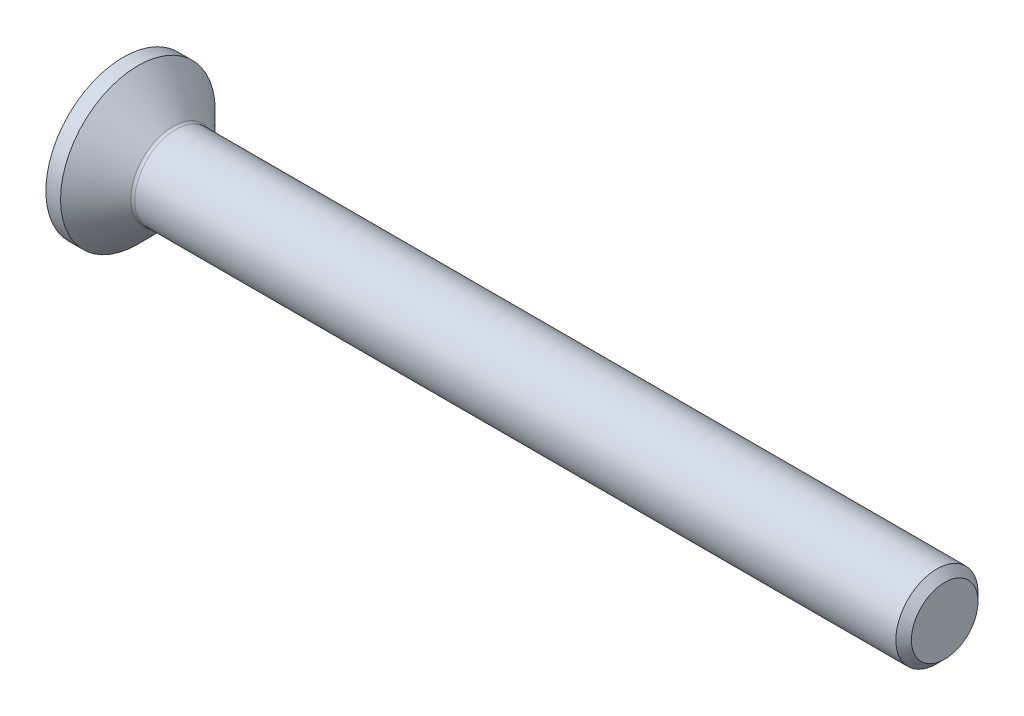
from build123d import *

# Parameters (mm, degrees)
HEXAGONSOCKET_DEPTH = 1.5
HEADFILLET_R        = 0.2
CHAMFER_2_SIZE      = 0.379
SKETCH4_W           = 5
SKETCH4_H           = 5


with BuildPart() as part:
    # Sketch1 → Base (revolve)
    with BuildSketch(Plane.XY, mode=Mode.PRIVATE) as base_sk:
        Polygon((0, 0), (0, 4.48), (2.48, 2), (40, 2), (40, 0), align=None)
    revolve(base_sk.sketch.rotate(Axis((-0.587069181, 0, 0), (1, 0, 0)), 90), axis=Axis((-0.587069181, 0, 0), (1, 0, 0)))

    # Sketch2 → HexagonSocket (cut)
    with BuildSketch(Plane(origin=(0, 0, 0), x_dir=(0, 0, -1), z_dir=(1, 0, 0))):
        Polygon((1.443375673, 0), (0.721687836, 1.25), (-0.721687836, 1.25), (-1.443375673, 0), (-0.721687836, -1.25), (0.721687836, -1.25), align=None)
    extrude(amount=HEXAGONSOCKET_DEPTH, mode=Mode.SUBTRACT)

    # Sketch3 → Cut-Revolve1 (revolve, cut)
    with BuildSketch(Plane.XY, mode=Mode.PRIVATE) as cut_revolve1_sk:
        Polygon((1.5, 1.25), (2.221687836, 0), (1.5, 0), align=None)
    revolve(cut_revolve1_sk.sketch.rotate(Axis((-0.439109555, 0, 0), (1, 0, 0)), 90), axis=Axis((-0.439109555, 0, 0), (1, 0, 0)), mode=Mode.SUBTRACT)

    # HeadFillet
    headfillet_edges = [part.edges().sort_by_distance(p)[0] for p in [
        (2.48, 0, -2),
    ]]
    fillet(headfillet_edges, radius=HEADFILLET_R)

    # Chamfer 2
    chamfer_2_edges = [part.edges().sort_by_distance(p)[0] for p in [
        (40, 0, -2),
    ]]
    chamfer(chamfer_2_edges, length=CHAMFER_2_SIZE)

    # Sketch4 → Cut-Revolve2 (revolve, cut)
    with BuildSketch(Plane(origin=(0, 0, 0), x_dir=(1, 0, 0), z_dir=(0, 1, 0)), mode=Mode.PRIVATE) as cut_revolve2_sk:
        with Locations((0.5, 6.265)):
            Rectangle(SKETCH4_W, SKETCH4_H)
    revolve(cut_revolve2_sk.sketch.rotate(Axis((11.853138686, 0, 0), (-1, 0, 0)), 180), axis=Axis((11.853138686, 0, 0), (-1, 0, 0)), mode=Mode.SUBTRACT)


solid = part.part
